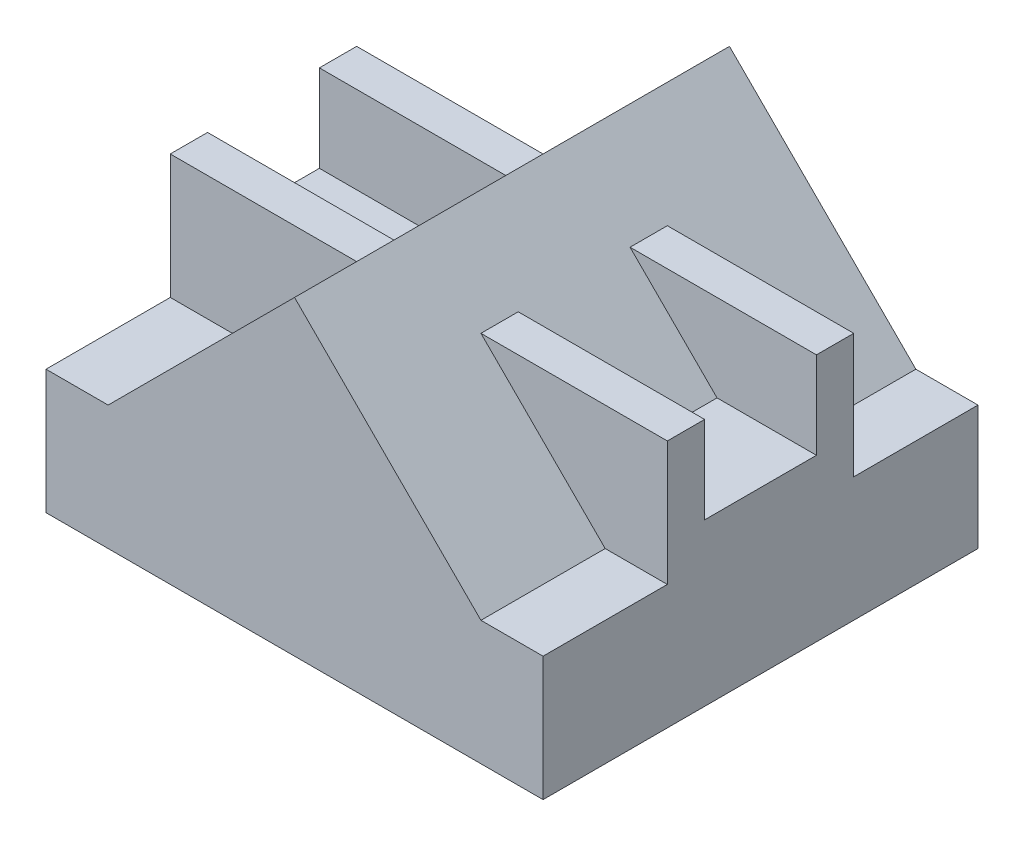
from build123d import *

# Parameters (mm, degrees)
SZKIC2_W                    = 200
SZKIC2_H                    = 175
DODANIE_WYCI_GNI_CIE1_DEPTH = 50
DODANIE_WYCI_GNI_CIE2_DEPTH = 175
DODANIE_WYCI_GNI_CIE3_REACH = 253.558


with BuildPart() as part:
    # Szkic2 → Dodanie-wyciągnięcie1 (new body)
    with BuildSketch(Plane(origin=(0, 0, 0), x_dir=(1, 0, 0), z_dir=(0, 1, 0))):
        Rectangle(SZKIC2_W, SZKIC2_H)
    extrude(amount=DODANIE_WYCI_GNI_CIE1_DEPTH)

    # Szkic3 → Dodanie-wyciągnięcie2 (add)
    with BuildSketch(Plane.XY.offset(87.5)):
        Polygon((-75, 50), (0, 125), (75, 50), align=None)
    extrude(amount=-DODANIE_WYCI_GNI_CIE2_DEPTH)

    # Dodanie-wyciągnięcie3: up to this face of the body (flat: up to its plane)
    dodanie_wyci_gni_cie3_end = Plane(part.part.faces().sort_by_distance((-100, 25, 0))[0])
    # Szkic4 → Dodanie-wyciągnięcie3 (add, up to the picked face)
    with BuildSketch(Plane(origin=(100, 0, 0), x_dir=(0, 0, -1), z_dir=(1, 0, 0)), mode=Mode.PRIVATE) as dodanie_wyci_gni_cie3_sk1:
        Polygon((-37.5, 50), (-37.5, 100), (-22.5, 100), (-22.5, 65), (22.5, 65), (22.5, 100), (37.5, 100), (37.5, 50), align=None)
    dodanie_wyci_gni_cie3_tool1 = split(extrude(dodanie_wyci_gni_cie3_sk1.sketch, amount=-DODANIE_WYCI_GNI_CIE3_REACH, mode=Mode.PRIVATE), bisect_by=dodanie_wyci_gni_cie3_end, keep=Keep.BOTH, mode=Mode.PRIVATE)
    add(dodanie_wyci_gni_cie3_tool1.solids().sort_by(Axis((100, 75, 36.598612), (-1, 0, 0)))[0])


solid = part.part
